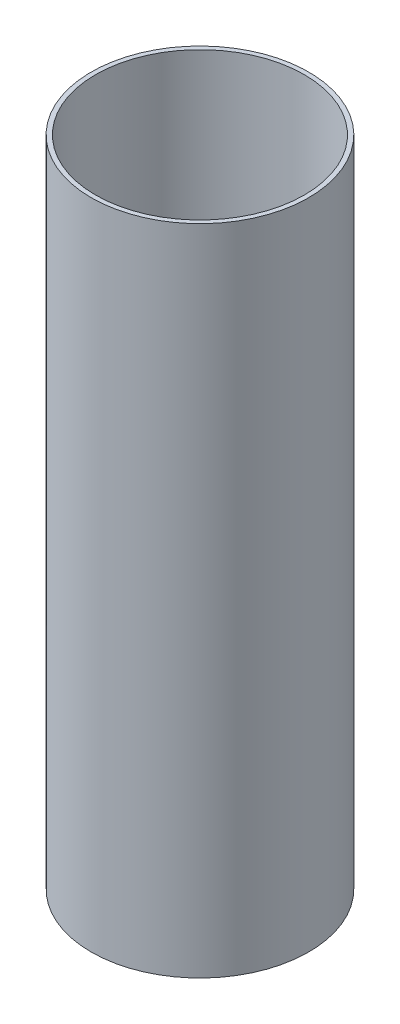
from build123d import *

# Parameters (mm, degrees)
SKETCH1_R           = 38.0746
SKETCH1_R_2         = 36.5125
BOSS_EXTRUDE1_DEPTH = 228.6


with BuildPart() as part:
    # Sketch1 → Boss-Extrude1 (new body)
    with BuildSketch(Plane(origin=(0, 0, 0), x_dir=(1, 0, 0), z_dir=(0, 1, 0))):
        Circle(SKETCH1_R)
        Circle(SKETCH1_R_2, mode=Mode.SUBTRACT)
    extrude(amount=BOSS_EXTRUDE1_DEPTH)


solid = part.part
